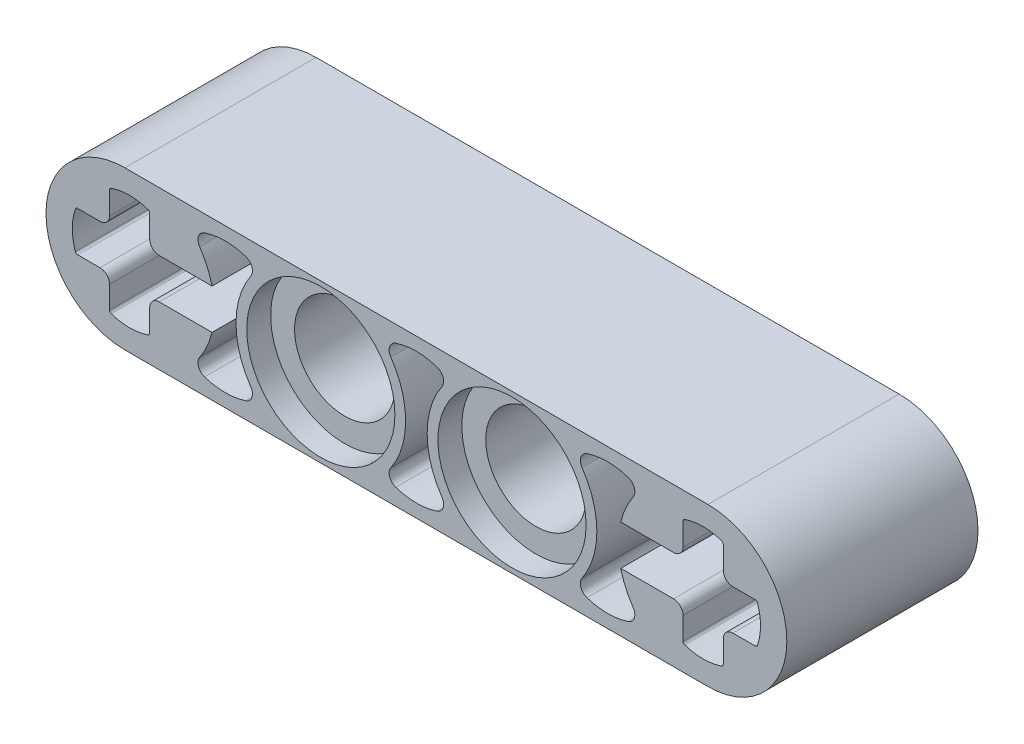
from build123d import *

# Parameters (mm, degrees)
SKETCH1_R           = 2.1
BOSS_EXTRUDE1_DEPTH = 4
SKETCH2_R           = 3.1
CUT_EXTRUDE1_DEPTH  = 1


with BuildPart() as part:
    # Sketch1 → Boss-Extrude1 (new, symmetric)
    with BuildSketch(Plane.XY):
        with BuildLine():
            Line((12.2, 3.3), (-12.2, 3.3))
            ThreePointArc((-12.2, 3.3), (-15.5, 0), (-12.2, -3.3))
            Line((-12.2, -3.3), (12.2, -3.3))
            ThreePointArc((12.2, -3.3), (15.5, 0), (12.2, 3.3))
        make_face()
        with BuildLine():
            Line((-14.177705214, 0.84), (-13.24, 0.84))
            ThreePointArc((-13.24, 0.84), (-12.957157288, 0.957157288), (-12.84, 1.24))
            Line((-12.84, 1.24), (-12.84, 2.177705214))
            ThreePointArc((-12.84, 2.177705214), (-12.821293884, 2.235940121), (-12.772173913, 2.27238805))
            ThreePointArc((-12.772173913, 2.27238805), (-12, 2.4), (-11.227826087, 2.27238805))
            ThreePointArc((-11.227826087, 2.27238805), (-11.178706116, 2.235940121), (-11.16, 2.177705214))
            Line((-11.16, 2.177705214), (-11.16, 1.24))
            ThreePointArc((-11.16, 1.24), (-11.042842712, 0.957157288), (-10.76, 0.84))
            Line((-10.76, 0.84), (-9.822294786, 0.84))
            Line((-9.822294786, 0.84), (-9.751800721, 0.84))
            Line((-9.751800721, 0.84), (-8.55081169, 0.84))
            ThreePointArc((-8.55081169, 0.84), (-8.757752494, 1.445797742), (-9.070126582, 2.004580194))
            ThreePointArc((-9.070126582, 2.004580194), (-9.119033599, 2.358251088), (-8.865957447, 2.610099174))
            ThreePointArc((-8.865957447, 2.610099174), (-8, 2.75), (-7.134042553, 2.610099174))
            ThreePointArc((-7.134042553, 2.610099174), (-6.880966401, 2.358251088), (-6.929873418, 2.004580194))
            ThreePointArc((-6.929873418, 2.004580194), (-7.55, 0), (-6.929873418, -2.004580194))
            ThreePointArc((-6.929873418, -2.004580194), (-6.880966401, -2.358251088), (-7.134042553, -2.610099174))
            ThreePointArc((-7.134042553, -2.610099174), (-8, -2.75), (-8.865957447, -2.610099174))
            ThreePointArc((-8.865957447, -2.610099174), (-9.119033599, -2.358251088), (-9.070126582, -2.004580194))
            ThreePointArc((-9.070126582, -2.004580194), (-8.757752494, -1.445797742), (-8.55081169, -0.84))
            Line((-8.55081169, -0.84), (-9.751800721, -0.84))
            Line((-9.751800721, -0.84), (-9.822294786, -0.84))
            Line((-9.822294786, -0.84), (-10.76, -0.84))
            ThreePointArc((-10.76, -0.84), (-11.042842712, -0.957157288), (-11.16, -1.24))
            Line((-11.16, -1.24), (-11.16, -2.177705214))
            ThreePointArc((-11.16, -2.177705214), (-11.178706116, -2.235940121), (-11.227826087, -2.27238805))
            ThreePointArc((-11.227826087, -2.27238805), (-12, -2.4), (-12.772173913, -2.27238805))
            ThreePointArc((-12.772173913, -2.27238805), (-12.821293884, -2.235940121), (-12.84, -2.177705214))
            Line((-12.84, -2.177705214), (-12.84, -1.24))
            ThreePointArc((-12.84, -1.24), (-12.957157288, -0.957157288), (-13.24, -0.84))
            Line((-13.24, -0.84), (-14.177705214, -0.84))
            ThreePointArc((-14.177705214, -0.84), (-14.235940121, -0.821293884), (-14.27238805, -0.772173913))
            ThreePointArc((-14.27238805, -0.772173913), (-14.4, 0), (-14.27238805, 0.772173913))
            ThreePointArc((-14.27238805, 0.772173913), (-14.235940121, 0.821293884), (-14.177705214, 0.84))
        make_face(mode=Mode.SUBTRACT)
        with BuildLine():
            ThreePointArc((0.865957447, -2.610099174), (0, -2.75), (-0.865957447, -2.610099174))
            ThreePointArc((-0.865957447, -2.610099174), (-1.119033599, -2.358251088), (-1.070126582, -2.004580194))
            ThreePointArc((-1.070126582, -2.004580194), (-0.45, 0), (-1.070126582, 2.004580194))
            ThreePointArc((-1.070126582, 2.004580194), (-1.119033599, 2.358251088), (-0.865957447, 2.610099174))
            ThreePointArc((-0.865957447, 2.610099174), (0, 2.75), (0.865957447, 2.610099174))
            ThreePointArc((0.865957447, 2.610099174), (1.119033599, 2.358251088), (1.070126582, 2.004580194))
            ThreePointArc((1.070126582, 2.004580194), (0.45, 0), (1.070126582, -2.004580194))
            ThreePointArc((1.070126582, -2.004580194), (1.119033599, -2.358251088), (0.865957447, -2.610099174))
        make_face(mode=Mode.SUBTRACT)
        with BuildLine():
            Line((12.84, 2.177705214), (12.84, 1.24))
            ThreePointArc((12.84, 1.24), (12.957157288, 0.957157288), (13.24, 0.84))
            Line((13.24, 0.84), (14.177705214, 0.84))
            ThreePointArc((14.177705214, 0.84), (14.235940121, 0.821293884), (14.27238805, 0.772173913))
            ThreePointArc((14.27238805, 0.772173913), (14.4, 0), (14.27238805, -0.772173913))
            ThreePointArc((14.27238805, -0.772173913), (14.235940121, -0.821293884), (14.177705214, -0.84))
            Line((14.177705214, -0.84), (13.24, -0.84))
            ThreePointArc((13.24, -0.84), (12.957157288, -0.957157288), (12.84, -1.24))
            Line((12.84, -1.24), (12.84, -2.177705214))
            ThreePointArc((12.84, -2.177705214), (12.821293884, -2.235940121), (12.772173913, -2.27238805))
            ThreePointArc((12.772173913, -2.27238805), (12, -2.4), (11.227826087, -2.27238805))
            ThreePointArc((11.227826087, -2.27238805), (11.178706116, -2.235940121), (11.16, -2.177705214))
            Line((11.16, -2.177705214), (11.16, -1.24))
            ThreePointArc((11.16, -1.24), (11.042842712, -0.957157288), (10.76, -0.84))
            Line((10.76, -0.84), (9.822294786, -0.84))
            Line((9.822294786, -0.84), (9.751800721, -0.84))
            Line((9.751800721, -0.84), (8.55081169, -0.84))
            ThreePointArc((8.55081169, -0.84), (8.757752494, -1.445797742), (9.070126582, -2.004580194))
            ThreePointArc((9.070126582, -2.004580194), (9.119033599, -2.358251088), (8.865957447, -2.610099174))
            ThreePointArc((8.865957447, -2.610099174), (8, -2.75), (7.134042553, -2.610099174))
            ThreePointArc((7.134042553, -2.610099174), (6.880966401, -2.358251088), (6.929873418, -2.004580194))
            ThreePointArc((6.929873418, -2.004580194), (7.55, 0), (6.929873418, 2.004580194))
            ThreePointArc((6.929873418, 2.004580194), (6.880966401, 2.358251088), (7.134042553, 2.610099174))
            ThreePointArc((7.134042553, 2.610099174), (8, 2.75), (8.865957447, 2.610099174))
            ThreePointArc((8.865957447, 2.610099174), (9.119033599, 2.358251088), (9.070126582, 2.004580194))
            ThreePointArc((9.070126582, 2.004580194), (8.757752494, 1.445797742), (8.55081169, 0.84))
            Line((8.55081169, 0.84), (9.751800721, 0.84))
            Line((9.751800721, 0.84), (9.822294786, 0.84))
            Line((9.822294786, 0.84), (10.76, 0.84))
            ThreePointArc((10.76, 0.84), (11.042842712, 0.957157288), (11.16, 1.24))
            Line((11.16, 1.24), (11.16, 2.177705214))
            ThreePointArc((11.16, 2.177705214), (11.178706116, 2.235940121), (11.227826087, 2.27238805))
            ThreePointArc((11.227826087, 2.27238805), (12, 2.4), (12.772173913, 2.27238805))
            ThreePointArc((12.772173913, 2.27238805), (12.821293884, 2.235940121), (12.84, 2.177705214))
        make_face(mode=Mode.SUBTRACT)
        with Locations((-4, 0)):
            Circle(SKETCH1_R, mode=Mode.SUBTRACT)
        with Locations((4, 0)):
            Circle(SKETCH1_R, mode=Mode.SUBTRACT)
    extrude(amount=BOSS_EXTRUDE1_DEPTH, both=True)

    # Sketch2 → Cut-Extrude1 (cut)
    with BuildSketch(Plane.XY.offset(4)):
        with Locations((-4, 0)):
            Circle(SKETCH2_R)
        with Locations((4, 0)):
            Circle(SKETCH2_R)
    cut_extrude1 = extrude(amount=-CUT_EXTRUDE1_DEPTH, mode=Mode.SUBTRACT)

    # Mirror1: Cut-Extrude1 across plane
    add(cut_extrude1.mirror(Plane.XY), mode=Mode.SUBTRACT)


solid = part.part
